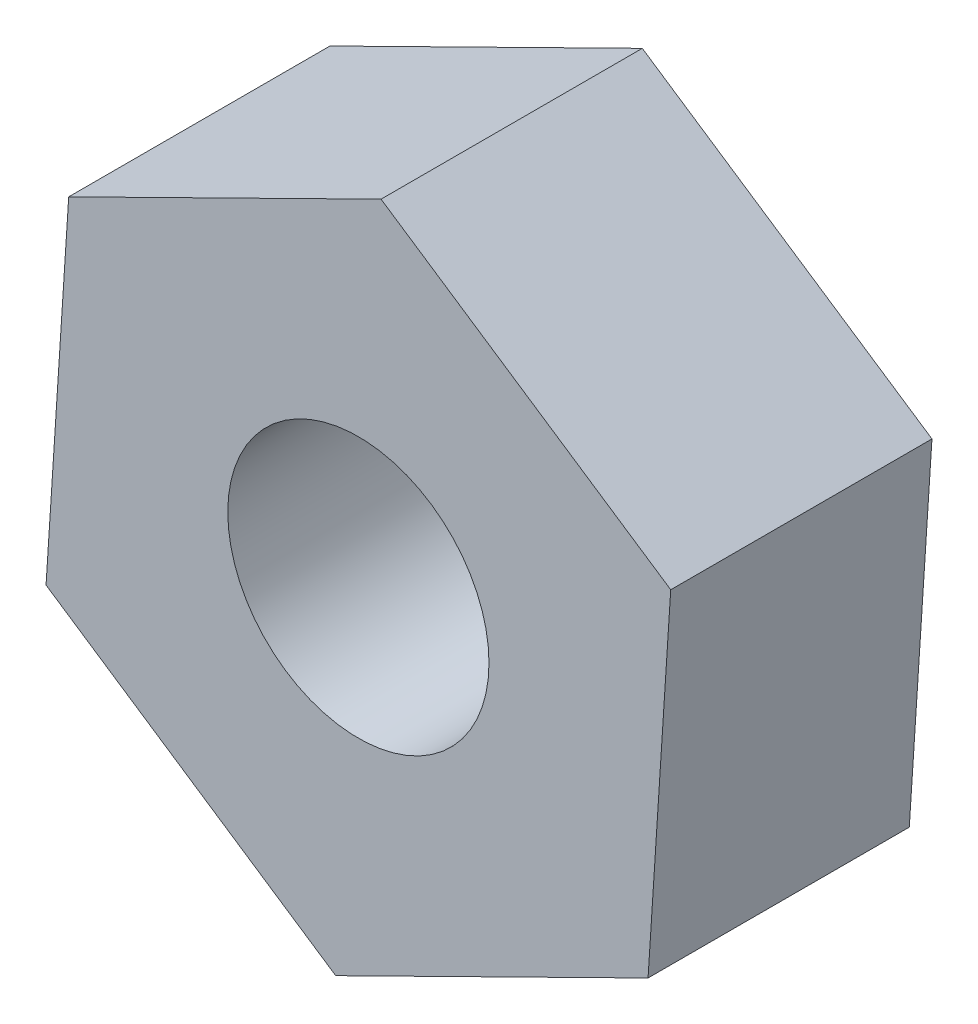
from build123d import *

# Parameters (mm, degrees)
BOSS_EXTRUDE1_DEPTH = 3
SKETCH2_R           = 1.5
CUT_EXTRUDE1_DEPTH  = 7.148040882


with BuildPart() as part:
    # Sketch1 → Boss-Extrude1 (new body)
    with BuildSketch(Plane.XY):
        Polygon((3.326557483, -2.221264349), (3.586950097, 1.770251113), (0.260392613, 3.991515462), (-3.326557483, 2.221264349), (-3.586950097, -1.770251113), (-0.260392613, -3.991515462), align=None)
    extrude(amount=BOSS_EXTRUDE1_DEPTH)

    # Sketch2 → Cut-Extrude1 (cut, through all)
    with BuildSketch(Plane.XY.offset(3)):
        Circle(SKETCH2_R)
    extrude(amount=-CUT_EXTRUDE1_DEPTH, mode=Mode.SUBTRACT)


solid = part.part
